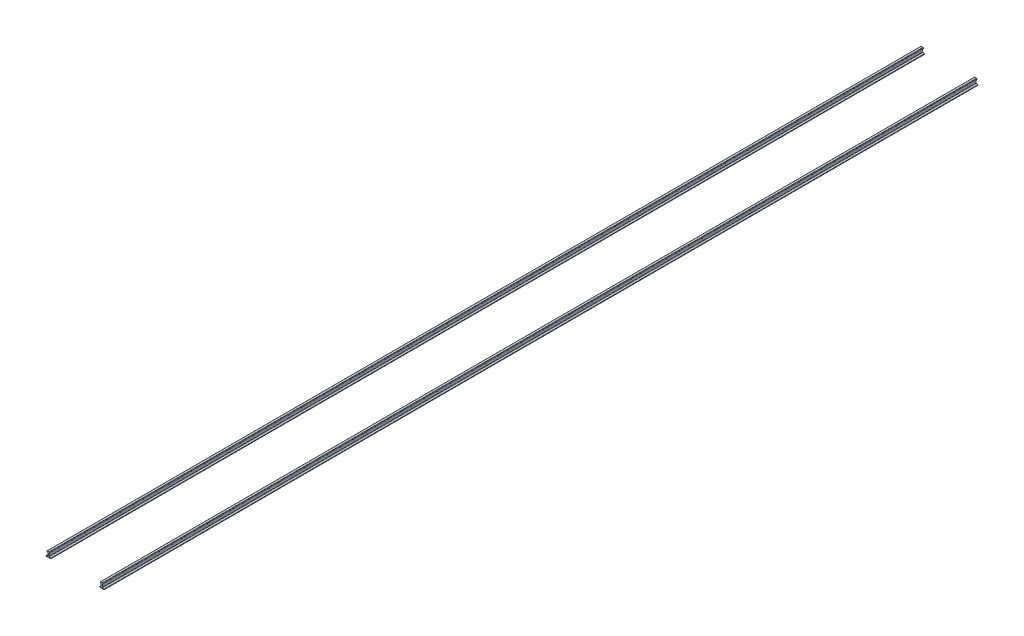
from build123d import *

# Parameters (mm, degrees)
EXTRUDE_1_DEPTH        = 24600
FILLET_1_R             = 10
FILLET_2_R             = 8
FILLET_3_R             = 3
FILLET_4_R             = 10
FILLET_5_R             = 3
PATTERN_LINEAR_1_COUNT = 2
PATTERN_LINEAR_1_PITCH = 1505


with BuildPart() as part:
    # 草图1 → 拉伸1 (new body)
    with BuildSketch(Plane.XY):
        Polygon((-35, 49.6), (-35, 83.5), (35, 83.5), (35, 49.6), (15, 44.6), (15, -41.6), (67, -54.6), (67, -68.5), (-65, -68.5), (-65, -54.6), (-15, -42.1), (-15, 44.6), align=None)
    extrude(amount=-EXTRUDE_1_DEPTH)

    # 圆角1
    fillet_1_edges = [part.edges().sort_by_distance(p)[0] for p in [
        (15, -41.6, -12300),
        (-15, -42.1, -12300),
    ]]
    fillet(fillet_1_edges, radius=FILLET_1_R)

    # 圆角2
    fillet_2_edges = [part.edges().sort_by_distance(p)[0] for p in [
        (15, 44.6, -12300),
        (-15, 44.6, -12300),
    ]]
    fillet(fillet_2_edges, radius=FILLET_2_R)

    # 圆角3
    fillet_3_edges = [part.edges().sort_by_distance(p)[0] for p in [
        (-35, 49.6, -12300),
        (35, 49.6, -12300),
    ]]
    fillet(fillet_3_edges, radius=FILLET_3_R)

    # 圆角4
    fillet_4_edges = [part.edges().sort_by_distance(p)[0] for p in [
        (-35, 83.5, -12300),
        (35, 83.5, -12300),
    ]]
    fillet(fillet_4_edges, radius=FILLET_4_R)

    # 圆角5
    fillet_5_edges = [part.edges().sort_by_distance(p)[0] for p in [
        (67, -54.6, -12300),
        (-65, -54.6, -12300),
    ]]
    fillet(fillet_5_edges, radius=FILLET_5_R)


with BuildPart() as pattern_linear_1_1:
    # 阵列(线性)1: pattern copy
    add(part.part.moved(Location(Vector(-1, 0, 0) * (1 * PATTERN_LINEAR_1_PITCH))))


solid = Compound([part.part, pattern_linear_1_1.part])
